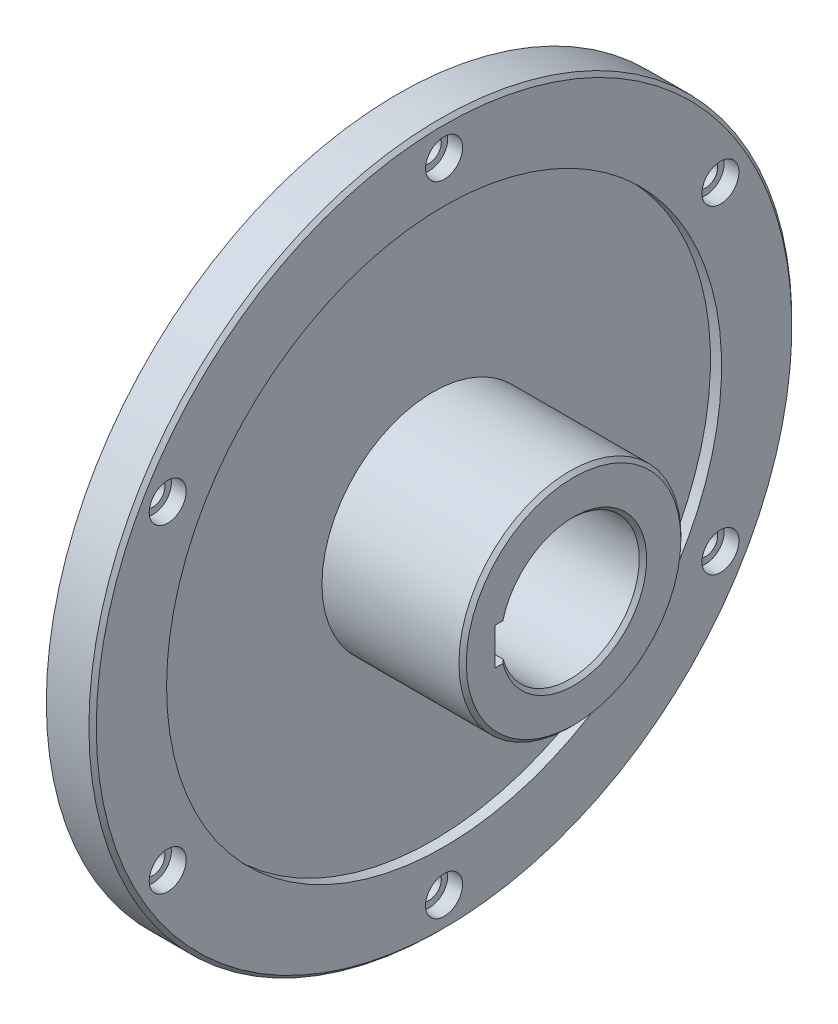
from build123d import *

# Parameters (mm, degrees)
CUT_EXTRUDE_1_DEPTH      = 281.922693463
CUT_EXTRUDE_1_DEPTH_BACK = 281.922693463
SKETCH_3_W               = 42.4
SKETCH_3_H               = 20
CUT_EXTRUDE_START        = 3.96072
SKETCH_4_R               = 10
CUT_EXTRUDE_2_DEPTH      = 8.000001
SKETCH_5_R               = 6.5
CUT_EXTRUDE_3_DEPTH      = 280.792780464
PATTERN_CIRCULAR_1_COUNT = 6
CHAMFER_1_SIZE           = 2


with BuildPart() as part:
    # Эскиз1 → Повернуть1 (revolve)
    with BuildSketch(Plane.XY, mode=Mode.PRIVATE) as revolve_1_sk:
        Polygon((-18.039279514, 135), (-18.039279514, 150), (-13.039279514, 150), (-13.039279514, 190), (11.960720486, 190), (11.960720486, 150), (5.960720486, 150), (5.960720486, 60), (81.960720486, 60), (81.960720486, 37.5), (-18.039279514, 37.5), (-18.039279514, 60), (-12.039279514, 60), (-12.039279514, 135), align=None)
    revolve(revolve_1_sk.sketch.rotate(Axis((-127.420307677, 0, 0), (1, 0, 0)), 90), axis=Axis((-127.420307677, 0, 0), (1, 0, 0)))

    # Эскиз3 → Вырез-Вытянуть1 (cut, two sides: drawn at the far end of the back side and taken through both)
    with BuildSketch(Plane(origin=(0, 0, 0), x_dir=(0, 0, -1), z_dir=(1, 0, 0)).offset(-CUT_EXTRUDE_1_DEPTH_BACK)):
        with Locations((-21.2, 0)):
            Rectangle(SKETCH_3_W, SKETCH_3_H)
    extrude(amount=CUT_EXTRUDE_1_DEPTH + CUT_EXTRUDE_1_DEPTH_BACK, mode=Mode.SUBTRACT)

    # Эскиз4 → Вырез-Вытянуть2 (cut)
    with BuildSketch(Plane(origin=(0, 0, 0), x_dir=(0, 0, -1), z_dir=(1, 0, 0)).offset(CUT_EXTRUDE_START)):
        with Locations(Location((0, -172.5, 0), (0, 0, 180))):
            Circle(SKETCH_4_R)
    cut_extrude_2 = extrude(amount=CUT_EXTRUDE_2_DEPTH, mode=Mode.SUBTRACT)

    # Эскиз5 → Вырез-Вытянуть3 (cut, through all)
    with BuildSketch(Plane(origin=(3.960720486, 0, 0), x_dir=(0, 0, -1), z_dir=(1, 0, 0))):
        with Locations((0, -172.5)):
            Circle(SKETCH_5_R)
    cut_extrude_3 = extrude(amount=-CUT_EXTRUDE_3_DEPTH, mode=Mode.SUBTRACT)

    # Круговой массив1: Вырез-Вытянуть2, Вырез-Вытянуть3 ×6 about axis
    pattern_circular_1_axis = Axis((0, 0, 0), (1, 0, 0))
    add([cut_extrude_2.rotate(pattern_circular_1_axis, i * 360 / PATTERN_CIRCULAR_1_COUNT) for i in range(1, PATTERN_CIRCULAR_1_COUNT)], mode=Mode.SUBTRACT)
    add([cut_extrude_3.rotate(pattern_circular_1_axis, i * 360 / PATTERN_CIRCULAR_1_COUNT) for i in range(1, PATTERN_CIRCULAR_1_COUNT)], mode=Mode.SUBTRACT)

    # Фаска1
    chamfer_1_edges = [part.edges().sort_by_distance(p)[0] for p in [
        (11.960720486, 0, -190),
        (81.960720486, 0, -60),
        (81.960720486, 0, -37.5),
        (-18.039279514, 0, -37.5),
        (-18.039279514, 0, -60),
        (-18.039279514, 0, -150),
    ]]
    chamfer(chamfer_1_edges, length=CHAMFER_1_SIZE)


solid = part.part
